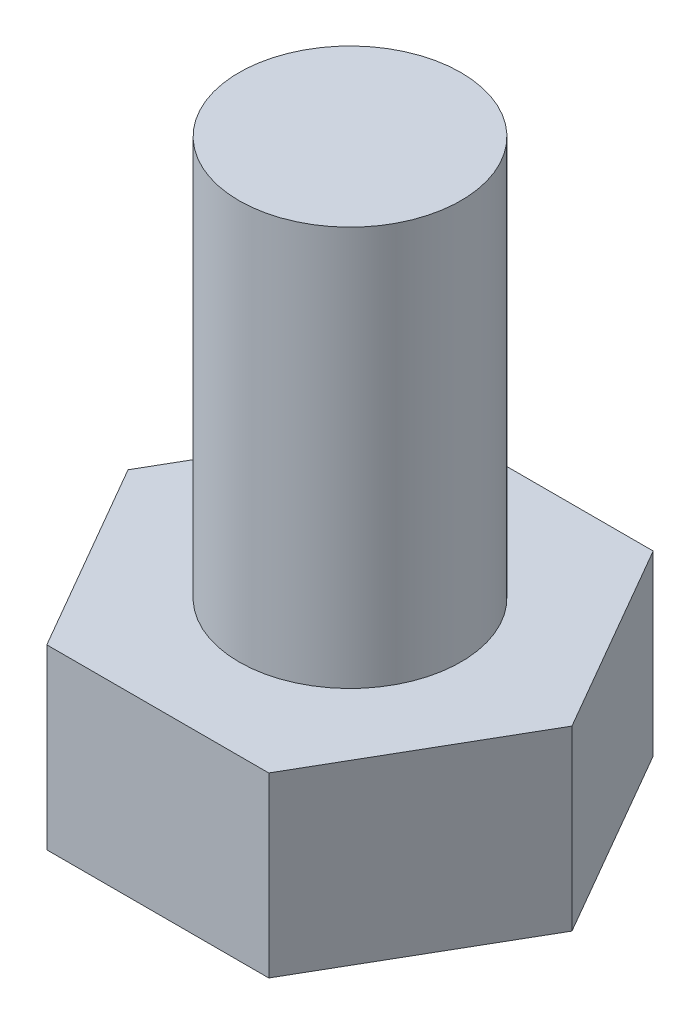
from build123d import *

# Parameters (mm, degrees)
SKETCH1_R           = 2.5
BOSS_EXTRUDE1_DEPTH = 13
SKETCH2_R           = 2.5
BOSS_EXTRUDE2_DEPTH = 4


with BuildPart() as part:
    # Sketch1 → Boss-Extrude1 (new body)
    with BuildSketch(Plane(origin=(0, 0, 0), x_dir=(1, 0, 0), z_dir=(0, 1, 0))):
        with Locations(Location((0, 0, 0), (0, 0, 90))):
            Circle(SKETCH1_R)
    extrude(amount=BOSS_EXTRUDE1_DEPTH)

    # Sketch2 → Boss-Extrude2 (add)
    with BuildSketch(Plane(origin=(0, 0, 0), x_dir=(1, 0, 0), z_dir=(0, 1, 0))):
        Polygon((2.5, -4.330127019), (5, 0), (2.5, 4.330127019), (-2.5, 4.330127019), (-5, 0), (-2.5, -4.330127019), align=None)
        with Locations(Location((0, 0, 0), (0, 0, 90))):
            Circle(SKETCH2_R, mode=Mode.SUBTRACT)
    extrude(amount=BOSS_EXTRUDE2_DEPTH)


solid = part.part
